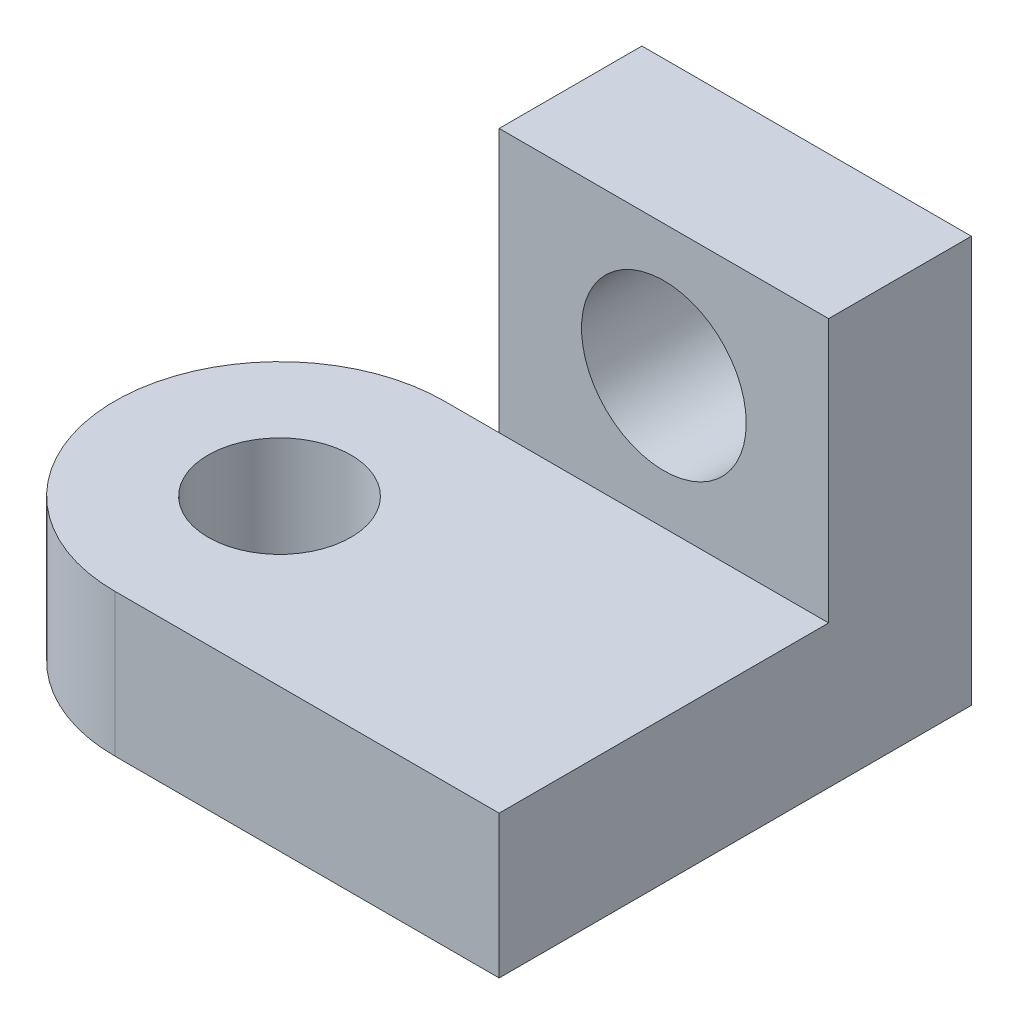
from build123d import *

# Parameters (mm, degrees)
BOSS_EXTRUDE3_DEPTH = 30
BOSS_EXTRUDE5_DEPTH = 13
SKETCH6_R           = 6.5
CUT_EXTRUDE1_DEPTH  = 13
SKETCH7_R           = 7.5
CUT_EXTRUDE2_DEPTH  = 13


with BuildPart() as part:
    # Sketch2 → Boss-Extrude3 (new body)
    with BuildSketch(Plane(origin=(0, 0, 0), x_dir=(0, 0, -1), z_dir=(1, 0, 0))):
        Polygon((0, 0), (0, 37), (-13, 37), (-13, 13), (-43, 13), (-43, 0), align=None)
    extrude(amount=BOSS_EXTRUDE3_DEPTH)

    # Sketch4 → Boss-Extrude5 (add)
    with BuildSketch(Plane(origin=(0, 13, 0), x_dir=(1, 0, 0), z_dir=(0, 1, 0))):
        with BuildLine():
            Line((0, -13), (0, -43))
            Line((0, -43), (-5, -43))
            ThreePointArc((-5, -43), (-20, -28), (-5, -13))
            Line((-5, -13), (0, -13))
        make_face()
    extrude(amount=-BOSS_EXTRUDE5_DEPTH)

    # Sketch6 → Cut-Extrude1 (cut)
    with BuildSketch(Plane(origin=(0, 13, 0), x_dir=(1, 0, 0), z_dir=(0, 1, 0))):
        with Locations(Location((-5, -28, 0), (0, 0, 270))):
            Circle(SKETCH6_R)
    extrude(amount=-CUT_EXTRUDE1_DEPTH, mode=Mode.SUBTRACT)

    # Sketch7 → Cut-Extrude2 (cut)
    with BuildSketch(Plane.XY.offset(13)):
        with Locations((15, 25)):
            Circle(SKETCH7_R)
    extrude(amount=-CUT_EXTRUDE2_DEPTH, mode=Mode.SUBTRACT)


solid = part.part
